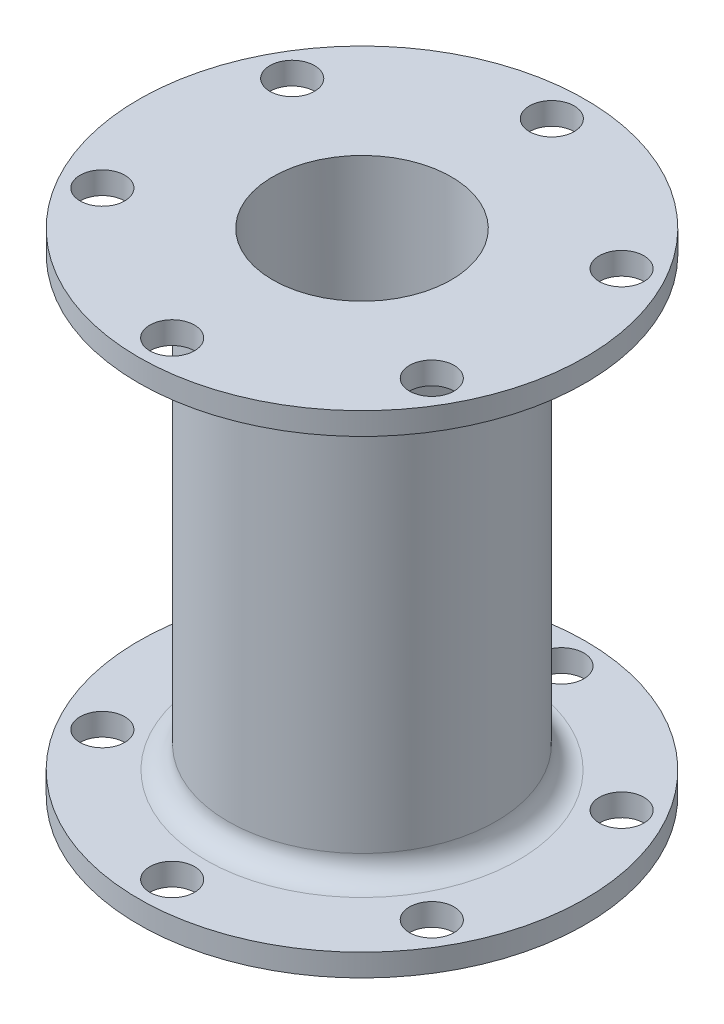
from build123d import *

# Parameters (mm, degrees)
SKETCH1_R           = 127
BOSS_EXTRUDE1_DEPTH = 12.7
SKETCH2_R           = 12.7
CUT_EXTRUDE1_DEPTH  = 12.7
SKETCH3_R           = 76.2
BOSS_EXTRUDE2_DEPTH = 254
BOSS_EXTRUDE3_START = 12.7
SKETCH4_R           = 127
BOSS_EXTRUDE3_DEPTH = 12.7
CUT_EXTRUDE2_START  = -12.7
SKETCH5_R           = 12.7
CUT_EXTRUDE2_DEPTH  = 12.7
FILLET1_R           = 12.7
SKETCH6_R           = 50.8
CUT_EXTRUDE3_DEPTH  = 325.12


with BuildPart() as part:
    # Sketch1 → Boss-Extrude1 (new body)
    with BuildSketch(Plane(origin=(0, 0, 0), x_dir=(1, 0, 0), z_dir=(0, 1, 0))):
        with Locations(Location((0, 0, 0), (0, 0, 270))):
            Circle(SKETCH1_R)
    extrude(amount=BOSS_EXTRUDE1_DEPTH)

    # Sketch2 → Cut-Extrude1 (cut)
    with BuildSketch(Plane(origin=(0, 12.7, 0), x_dir=(1, 0, 0), z_dir=(0, 1, 0))):
        with Locations(Location((0, 107.95, 0), (0, 0, 270))):
            Circle(SKETCH2_R)
        with Locations(Location((0, -107.95, 0), (0, 0, 270))):
            Circle(SKETCH2_R)
        with Locations(Location((-93.6625, 53.975, 0), (0, 0, 270))):
            Circle(SKETCH2_R)
        with Locations(Location((93.6625, 53.975, 0), (0, 0, 270))):
            Circle(SKETCH2_R)
        with Locations(Location((-93.6625, -53.975, 0), (0, 0, 270))):
            Circle(SKETCH2_R)
        with Locations(Location((93.6625, -53.975, 0), (0, 0, 270))):
            Circle(SKETCH2_R)
    extrude(amount=-CUT_EXTRUDE1_DEPTH, mode=Mode.SUBTRACT)

    # Sketch3 → Boss-Extrude2 (add)
    with BuildSketch(Plane.XZ):
        with Locations(Location((0, 0, 0), (0, 0, 90))):
            Circle(SKETCH3_R)
    extrude(amount=BOSS_EXTRUDE2_DEPTH)

    # Sketch4 → Boss-Extrude3 (add)
    with BuildSketch(Plane.XZ.offset(254).offset(BOSS_EXTRUDE3_START)):
        with Locations(Location((0, 0, 0), (0, 0, 90))):
            Circle(SKETCH4_R)
    extrude(amount=-BOSS_EXTRUDE3_DEPTH)

    # Sketch5 → Cut-Extrude2 (cut)
    with BuildSketch(Plane.XZ.offset(266.7).offset(CUT_EXTRUDE2_START)):
        with Locations(Location((0, 107.95, 0), (0, 0, 90))):
            Circle(SKETCH5_R)
        with Locations(Location((5.510274908, -107.95, 0), (0, 0, 270))):
            Circle(SKETCH5_R)
        with Locations(Location((-93.6625, 53.975, 0), (0, 0, 90))):
            Circle(SKETCH5_R)
        with Locations(Location((93.6625, 53.975, 0), (0, 0, 90))):
            Circle(SKETCH5_R)
        with Locations(Location((-93.6625, -53.975, 0), (0, 0, 90))):
            Circle(SKETCH5_R)
        with Locations(Location((93.6625, -53.975, 0), (0, 0, 90))):
            Circle(SKETCH5_R)
    extrude(amount=CUT_EXTRUDE2_DEPTH, mode=Mode.SUBTRACT)

    # Fillet1
    fillet1_edges = [part.edges().sort_by_distance(p)[0] for p in [
        (0, 0, -76.2),
        (0, -254, -76.2),
    ]]
    fillet(fillet1_edges, radius=FILLET1_R)

    # Sketch6 → Cut-Extrude3 (cut)
    with BuildSketch(Plane(origin=(0, 12.7, 0), x_dir=(1, 0, 0), z_dir=(0, 1, 0))):
        with Locations(Location((0, 0, 0), (0, 0, 270))):
            Circle(SKETCH6_R)
    extrude(amount=-CUT_EXTRUDE3_DEPTH, mode=Mode.SUBTRACT)


solid = part.part
